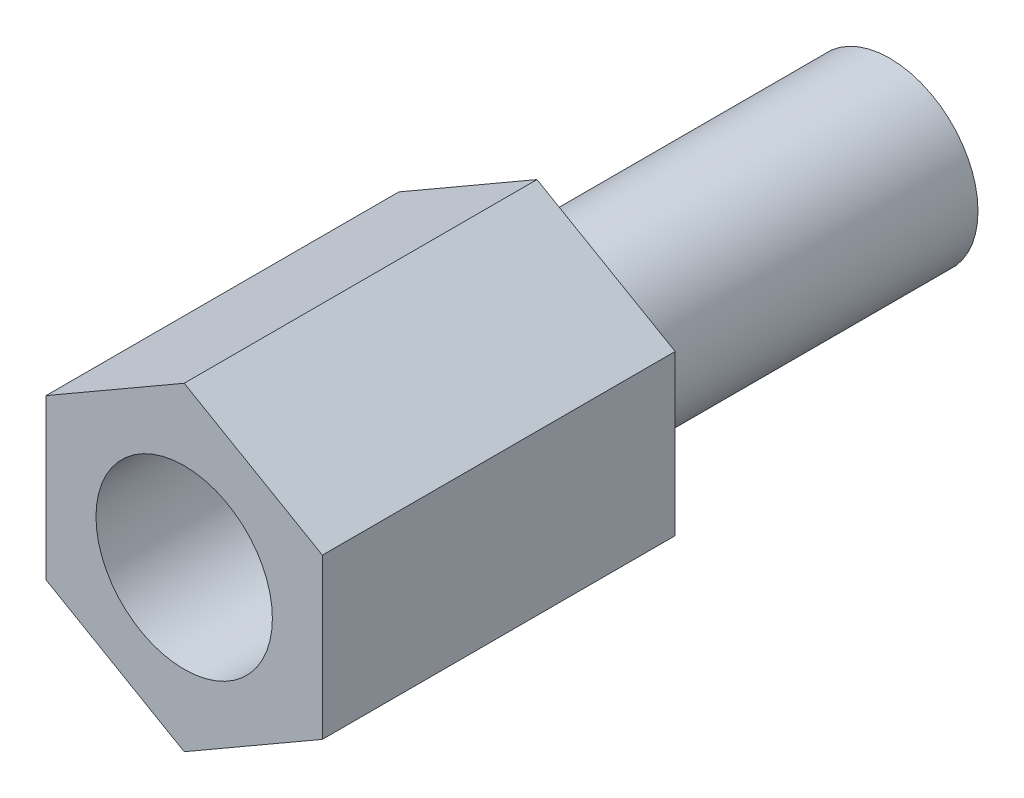
from build123d import *

# Parameters (mm, degrees)
SKETCH1_R           = 1.5
BOSS_EXTRUDE1_DEPTH = 6
SKETCH1_2_R         = 1.5
BOSS_EXTRUDE2_DEPTH = 6


with BuildPart() as part:
    # Sketch1 → Boss-Extrude1 (new body)
    with BuildSketch(Plane(origin=(0, 0, 0), x_dir=(0, 1, 0), z_dir=(0, 0, 1))):
        Polygon((2.713546265, 0), (1.356773133, 2.35), (-1.356773133, 2.35), (-2.713546265, 0), (-1.356773133, -2.35), (1.356773133, -2.35), align=None)
        Circle(SKETCH1_R, mode=Mode.SUBTRACT)
    extrude(amount=BOSS_EXTRUDE1_DEPTH)


with BuildPart() as body_2:
    # Sketch1<2> → Boss-Extrude2 (new body)
    with BuildSketch(Plane(origin=(0, 0, 0), x_dir=(0, 1, 0), z_dir=(0, 0, 1))):
        Circle(SKETCH1_2_R)
    extrude(amount=-BOSS_EXTRUDE2_DEPTH)


solid = Compound([part.part, body_2.part])
